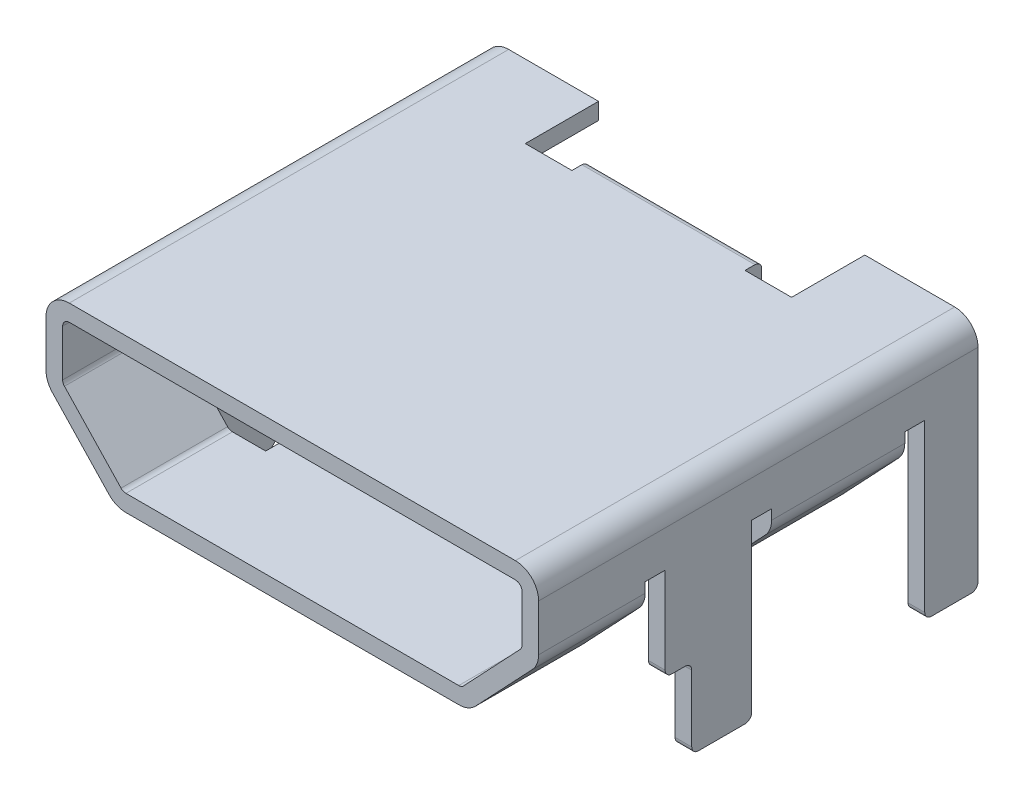
from build123d import *

# Parameters (mm, degrees)
EXTRUDE_1_DEPTH     = 6.6
SKETCH_2_W          = 4
SKETCH_2_H          = 1.1
CUT_EXTRUDE_1_DEPTH = 6.6
EXTRUDE_2_DEPTH     = 1
SKETCH_4_W          = 3.4
SKETCH_4_H          = 0.4
EXTRUDE_3_DEPTH     = 3.9
CHAMFER_1_SIZE      = 0.1
CHAMFER_1_SIZE2     = 0.173205081
SKETCH_5_W          = 8
SKETCH_5_H          = 1.5
SKETCH_5_W_2        = 2
SKETCH_5_H_2        = 1.9
CUT_EXTRUDE_2_DEPTH = 1.4
SKETCH_6_W          = 0.25
SKETCH_6_H          = 0.8
SKETCH_6_H_2        = 0.9
EXTRUDE_5_DEPTH     = 2.6
SKETCH_7_W          = 0.25
SKETCH_7_H          = 0.4
EXTRUDE_6_DEPTH     = 1.4
SKETCH_8_W          = 0.3
SKETCH_8_H          = 0.2
EXTRUDE_7_DEPTH     = 1.4
SKETCH_9_W          = 0.3
SKETCH_9_H          = 3.7
EXTRUDE_8_DEPTH     = 0.01
SKETCH_10_W         = 2.6
SKETCH_10_H         = 1.6
EXTRUDE_9_DEPTH     = 0.25
FILLET_1_R          = 0.1


with BuildPart() as part:
    # 草图1 → 凸台-拉伸1 (new body)
    with BuildSketch(Plane.XY):
        with BuildLine():
            Line((-3.35, 1.15), (3.35, 1.15))
            ThreePointArc((3.35, 1.15), (3.597487373, 1.047487373), (3.7, 0.8))
            Line((3.7, 0.8), (3.7, 0.1))
            ThreePointArc((3.7, 0.1), (3.675237691, -0.029307557), (3.604454603, -0.140318237))
            Line((3.604454603, -0.140318237), (2.754454603, -1.040318237))
            ThreePointArc((2.754454603, -1.040318237), (2.638543526, -1.121412027), (2.5, -1.15))
            Line((2.5, -1.15), (-2.5, -1.15))
            ThreePointArc((-2.5, -1.15), (-2.638543526, -1.121412027), (-2.754454603, -1.040318237))
            Line((-2.754454603, -1.040318237), (-3.604454603, -0.140318237))
            ThreePointArc((-3.604454603, -0.140318237), (-3.675237691, -0.029307557), (-3.7, 0.1))
            Line((-3.7, 0.1), (-3.7, 0.8))
            ThreePointArc((-3.7, 0.8), (-3.597487373, 1.047487373), (-3.35, 1.15))
        make_face()
        with BuildLine():
            Line((-3.35, 0.9), (3.35, 0.9))
            ThreePointArc((3.35, 0.9), (3.420710678, 0.870710678), (3.45, 0.8))
            Line((3.45, 0.8), (3.45, 0.1))
            ThreePointArc((3.45, 0.1), (3.442925055, 0.063054984), (3.422701315, 0.031337647))
            Line((3.422701315, 0.031337647), (2.572701315, -0.868662353))
            ThreePointArc((2.572701315, -0.868662353), (2.539583865, -0.891832008), (2.5, -0.9))
            Line((2.5, -0.9), (-2.5, -0.9))
            ThreePointArc((-2.5, -0.9), (-2.539583865, -0.891832008), (-2.572701315, -0.868662353))
            Line((-2.572701315, -0.868662353), (-3.422701315, 0.031337647))
            ThreePointArc((-3.422701315, 0.031337647), (-3.442925055, 0.063054984), (-3.45, 0.1))
            Line((-3.45, 0.1), (-3.45, 0.8))
            ThreePointArc((-3.45, 0.8), (-3.420710678, 0.870710678), (-3.35, 0.9))
        make_face(mode=Mode.SUBTRACT)
    extrude(amount=EXTRUDE_1_DEPTH)

    # 草图2 → 切除-拉伸1 (cut)
    with BuildSketch(Plane.XZ.offset(1.15)):
        with Locations((0, 0.55)):
            Rectangle(SKETCH_2_W, SKETCH_2_H)
    extrude(amount=-CUT_EXTRUDE_1_DEPTH, mode=Mode.SUBTRACT)

    # 草图3 → 凸台-拉伸2 (add)
    with BuildSketch(Plane(origin=(0, 0, 1.1), x_dir=(-1, 0, 0), z_dir=(0, 0, -1))):
        with BuildLine():
            Line((2.572701315, -0.868662353), (3.422701315, 0.031337647))
            ThreePointArc((3.422701315, 0.031337647), (3.442925055, 0.063054984), (3.45, 0.1))
            Line((3.45, 0.1), (3.45, 0.8))
            ThreePointArc((3.45, 0.8), (3.420710678, 0.870710678), (3.35, 0.9))
            Line((3.35, 0.9), (-3.35, 0.9))
            ThreePointArc((-3.35, 0.9), (-3.420710678, 0.870710678), (-3.45, 0.8))
            Line((-3.45, 0.8), (-3.45, 0.1))
            ThreePointArc((-3.45, 0.1), (-3.442925055, 0.063054984), (-3.422701315, 0.031337647))
            Line((-3.422701315, 0.031337647), (-2.572701315, -0.868662353))
            ThreePointArc((-2.572701315, -0.868662353), (-2.539583865, -0.891832008), (-2.5, -0.9))
            Line((-2.5, -0.9), (2.5, -0.9))
            ThreePointArc((2.5, -0.9), (2.539583865, -0.891832008), (2.572701315, -0.868662353))
        make_face()
    extrude(amount=-EXTRUDE_2_DEPTH)

    # 草图4 → 凸台-拉伸3 (add)
    with BuildSketch(Plane.XY.offset(2.1)):
        with Locations((0, 0.4)):
            Rectangle(SKETCH_4_W, SKETCH_4_H)
    extrude(amount=EXTRUDE_3_DEPTH)

    # 倒角1
    chamfer_1_edges = [part.edges().sort_by_distance(p)[0] for p in [
        (0, 0.2, 6),
    ]]
    chamfer_1_side = [part.faces().sort_by_distance(p)[0] for p in [
        (0, 0.4, 6),
    ]]
    chamfer(chamfer_1_edges, length=CHAMFER_1_SIZE, length2=CHAMFER_1_SIZE2, reference=chamfer_1_side[0])

    # 草图5 → 切除-拉伸2 (cut)
    with BuildSketch(Plane.XZ.offset(1.15)):
        with Locations((0, 0.35)):
            Rectangle(SKETCH_5_W, SKETCH_5_H)
        with Locations((3, 4.05)):
            Rectangle(SKETCH_5_W_2, SKETCH_5_H_2)
        with Locations((-3, 4.05)):
            Rectangle(SKETCH_5_W_2, SKETCH_5_H_2)
    extrude(amount=-CUT_EXTRUDE_2_DEPTH, mode=Mode.SUBTRACT)

    # 草图6 → 凸台-拉伸5 (add)
    with BuildSketch(Plane.XZ.offset(-0.25)):
        with Locations((3.575, 0.4)):
            Rectangle(SKETCH_6_W, SKETCH_6_H)
        with Locations((3.575, 3.85)):
            Rectangle(SKETCH_6_W, SKETCH_6_H_2)
        with Locations((-3.575, 3.85)):
            Rectangle(SKETCH_6_W, SKETCH_6_H_2)
        with Locations((-3.575, 0.4)):
            Rectangle(SKETCH_6_W, SKETCH_6_H)
    extrude(amount=EXTRUDE_5_DEPTH)

    # 草图7 → 凸台-拉伸6 (add)
    with BuildSketch(Plane.XZ.offset(-0.25)):
        with Locations((3.575, 4.5)):
            Rectangle(SKETCH_7_W, SKETCH_7_H)
        with Locations((-3.575, 4.5)):
            Rectangle(SKETCH_7_W, SKETCH_7_H)
    extrude(amount=EXTRUDE_6_DEPTH)

    # 草图8 → 凸台-拉伸7 (add)
    with BuildSketch(Plane(origin=(0, 0, 1.4), x_dir=(-1, 0, 0), z_dir=(0, 0, -1))):
        with Locations((-0.65, -1.2)):
            Rectangle(SKETCH_8_W, SKETCH_8_H)
        with Locations((0, -1.2)):
            Rectangle(SKETCH_8_W, SKETCH_8_H)
        with Locations((0.65, -1.2)):
            Rectangle(SKETCH_8_W, SKETCH_8_H)
        with Locations((1.3, -1.2)):
            Rectangle(SKETCH_8_W, SKETCH_8_H)
        with Locations((-1.3, -1.2)):
            Rectangle(SKETCH_8_W, SKETCH_8_H)
    extrude(amount=EXTRUDE_7_DEPTH)

    # 草图9 → 凸台-拉伸8 (add)
    with BuildSketch(Plane.XZ.offset(-0.2)):
        with Locations((-1.3, 3.95)):
            Rectangle(SKETCH_9_W, SKETCH_9_H)
        with Locations((-0.65, 3.95)):
            Rectangle(SKETCH_9_W, SKETCH_9_H)
        with Locations((0, 3.95)):
            Rectangle(SKETCH_9_W, SKETCH_9_H)
        with Locations((0.65, 3.95)):
            Rectangle(SKETCH_9_W, SKETCH_9_H)
        with Locations((1.3, 3.95)):
            Rectangle(SKETCH_9_W, SKETCH_9_H)
    extrude(amount=EXTRUDE_8_DEPTH)

    # 草图10 → 凸台-拉伸9 (add)
    with BuildSketch(Plane(origin=(0, 0, 1.1), x_dir=(-1, 0, 0), z_dir=(0, 0, -1))):
        with Locations((0, 0.35)):
            Rectangle(SKETCH_10_W, SKETCH_10_H)
    extrude(amount=EXTRUDE_9_DEPTH)

    # 圆角1
    fillet_1_edges = [part.edges().sort_by_distance(p)[0] for p in [
        (3.575, -2.35, 0),
        (3.575, -2.35, 0.8),
        (3.575, -2.35, 3.4),
        (3.575, -2.35, 4.3),
        (-3.575, -2.35, 4.3),
        (-3.575, -2.35, 3.4),
        (-3.575, -2.35, 0.8),
        (-3.575, -2.35, 0),
        (3.575, -1.15, 4.3),
        (3.575, -1.15, 4.7),
        (-3.575, -1.15, 4.7),
        (-3.575, -1.15, 4.3),
        (0, 1.15, 0.85),
    ]]
    fillet(fillet_1_edges, radius=FILLET_1_R)


solid = part.part
